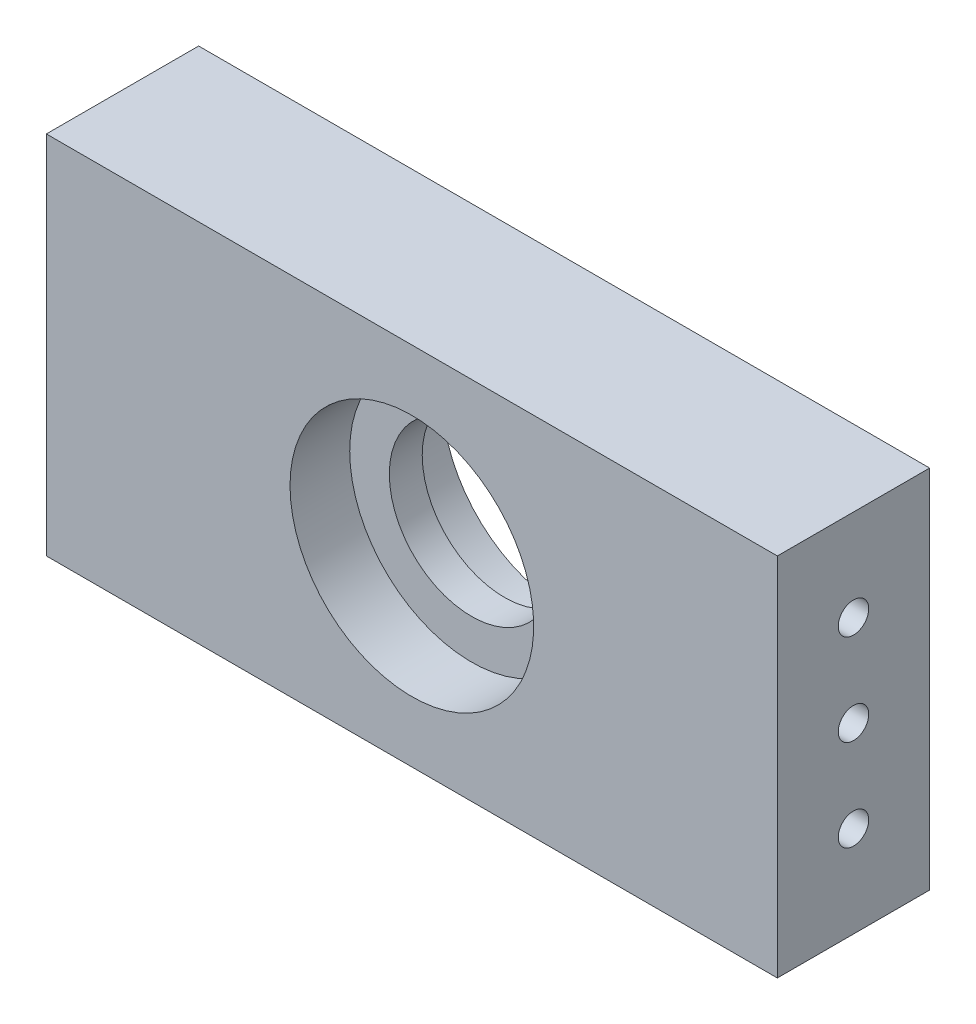
from build123d import *

# Parameters (mm, degrees)
SKETCH1_W           = 152.4
SKETCH1_H           = 76.2
BOSS_EXTRUDE1_DEPTH = 31.75
SKETCH2_R           = 17.145
CUT_EXTRUDE1_DEPTH  = 174.321269612
SKETCH2_2_R         = 25.4
SKETCH2_2_R_2       = 17.145
CUT_EXTRUDE3_DEPTH  = 12.446
SKETCH3_R           = 3.175
CUT_EXTRUDE4_DEPTH  = 31.75


with BuildPart() as part:
    # Sketch1 → Boss-Extrude1 (new body)
    with BuildSketch(Plane.XY):
        with Locations((76.2, 38.1)):
            Rectangle(SKETCH1_W, SKETCH1_H)
    extrude(amount=BOSS_EXTRUDE1_DEPTH)

    # Sketch2 → Cut-Extrude1 (cut, through all)
    with BuildSketch(Plane(origin=(0, 0, 0), x_dir=(-1, 0, 0), z_dir=(0, 0, -1))):
        with Locations((-76.2, 38.1)):
            Circle(SKETCH2_R)
    extrude(amount=-CUT_EXTRUDE1_DEPTH, mode=Mode.SUBTRACT)

    # Sketch2<2> → Cut-Extrude3 (cut)
    with BuildSketch(Plane(origin=(0, 0, 0), x_dir=(-1, 0, 0), z_dir=(0, 0, -1))):
        with Locations((-76.2, 38.1)):
            Circle(SKETCH2_2_R)
        with Locations((-76.2, 38.1)):
            Circle(SKETCH2_2_R_2, mode=Mode.SUBTRACT)
    cut_extrude3 = extrude(amount=-CUT_EXTRUDE3_DEPTH, mode=Mode.SUBTRACT)

    # Mirror2: Cut-Extrude3 across plane
    add(cut_extrude3.mirror(Plane(origin=(0, 0, 15.875), x_dir=(1, 0, 0), z_dir=(0, 0, -1))), mode=Mode.SUBTRACT)

    # Sketch3 → Cut-Extrude4 (cut)
    with BuildSketch(Plane(origin=(152.4, 0, 0), x_dir=(0, 0, -1), z_dir=(1, 0, 0))):
        with Locations((-15.875, 57.15)):
            Circle(SKETCH3_R)
        with Locations((-15.875, 19.05)):
            Circle(SKETCH3_R)
        with Locations((-15.875, 38.1)):
            Circle(SKETCH3_R)
    extrude(amount=-CUT_EXTRUDE4_DEPTH, mode=Mode.SUBTRACT)


solid = part.part
